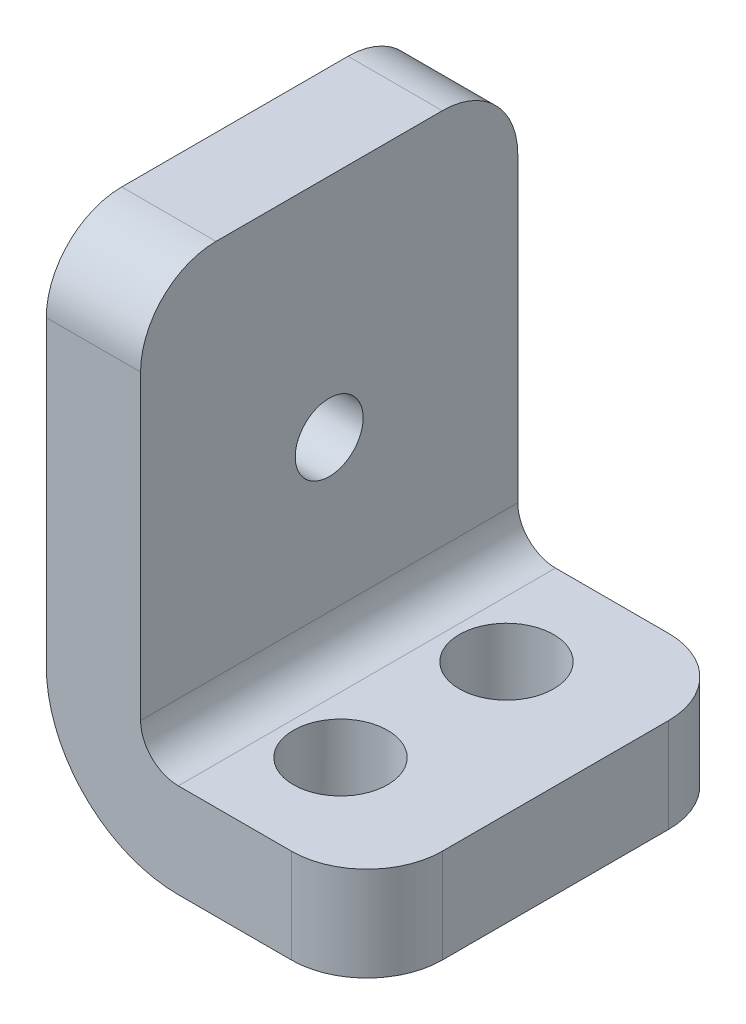
from build123d import *

# Parameters (mm, degrees)
BOSS_EXTRUDE1_DEPTH = 12.7
FILLET1_R           = 2.54
SKETCH2_R           = 1.143
CUT_EXTRUDE1_DEPTH  = 3.175
CUT_EXTRUDE2_REACH  = 22.36


with BuildPart() as part:
    # Sketch1 → Boss-Extrude1 (new body)
    with BuildSketch(Plane.XY):
        with BuildLine():
            Line((0, 25.690786623), (0, 12.990786623))
            ThreePointArc((0, 12.990786623), (0.371974388, 12.092761011), (1.27, 11.720786623))
            Line((1.27, 11.720786623), (7.62, 11.720786623))
            Line((7.62, 11.720786623), (7.62, 8.545786623))
            Line((7.62, 8.545786623), (1.27, 8.545786623))
            ThreePointArc((1.27, 8.545786623), (-1.873089642, 9.847696981), (-3.175, 12.990786623))
            Line((-3.175, 12.990786623), (-3.175, 25.690786623))
            Line((-3.175, 25.690786623), (0, 25.690786623))
        make_face()
    extrude(amount=BOSS_EXTRUDE1_DEPTH)

    # Fillet1
    fillet1_edges = [part.edges().sort_by_distance(p)[0] for p in [
        (-1.5875, 25.690786623, 0),
        (7.62, 10.133286623, 12.7),
        (-1.5875, 25.690786623, 12.7),
        (7.62, 10.133286623, 0),
    ]]
    fillet(fillet1_edges, radius=FILLET1_R)

    # Sketch2 → Cut-Extrude1 (cut)
    with BuildSketch(Plane(origin=(0, 0, 0), x_dir=(0, 0, -1), z_dir=(1, 0, 0))):
        with Locations((-6.35, 18.070786623)):
            Circle(SKETCH2_R)
    extrude(amount=-CUT_EXTRUDE1_DEPTH, mode=Mode.SUBTRACT)

    # Sketch3 → Cut-Extrude2 (cut, up to next)
    with BuildSketch(Plane(origin=(0, 11.720786623, 0), x_dir=(1, 0, 0), z_dir=(0, 1, 0)), mode=Mode.PRIVATE) as cut_extrude2_sk1:
        with BuildLine():
            ThreePointArc((3.175, -7.5565), (1.5875, -9.144), (3.175, -10.7315))
            Line((3.175, -10.7315), (3.175, -7.5565))
        make_face()
    cut_extrude2_tool1 = extrude(cut_extrude2_sk1.sketch, amount=-CUT_EXTRUDE2_REACH, mode=Mode.PRIVATE) & part.part
    # Sketch3 → Cut-Extrude2 (cut, up to next)
    with BuildSketch(Plane(origin=(0, 11.720786623, 0), x_dir=(1, 0, 0), z_dir=(0, 1, 0)), mode=Mode.PRIVATE) as cut_extrude2_sk2:
        with BuildLine():
            Line((3.175, -7.5565), (3.175, -10.7315))
            ThreePointArc((3.175, -10.7315), (4.297532015, -10.266532015), (4.7625, -9.144))
            ThreePointArc((4.7625, -9.144), (4.297532015, -8.021467985), (3.175, -7.5565))
        make_face()
    cut_extrude2_tool2 = extrude(cut_extrude2_sk2.sketch, amount=-CUT_EXTRUDE2_REACH, mode=Mode.PRIVATE) & part.part
    # Sketch3 → Cut-Extrude2 (cut, up to next)
    with BuildSketch(Plane(origin=(0, 11.720786623, 0), x_dir=(1, 0, 0), z_dir=(0, 1, 0)), mode=Mode.PRIVATE) as cut_extrude2_sk3:
        with BuildLine():
            ThreePointArc((3.175, -7.5565), (1.5875, -9.144), (3.175, -10.7315))
            Line((3.175, -10.7315), (3.175, -7.5565))
        make_face()
    cut_extrude2_tool3 = extrude(cut_extrude2_sk3.sketch, amount=-CUT_EXTRUDE2_REACH, mode=Mode.PRIVATE) & part.part
    # Sketch3 → Cut-Extrude2 (cut, up to next)
    with BuildSketch(Plane(origin=(0, 11.720786623, 0), x_dir=(1, 0, 0), z_dir=(0, 1, 0)), mode=Mode.PRIVATE) as cut_extrude2_sk4:
        with BuildLine():
            Line((3.175, -7.5565), (3.175, -10.7315))
            ThreePointArc((3.175, -10.7315), (4.297532015, -10.266532015), (4.7625, -9.144))
            ThreePointArc((4.7625, -9.144), (4.297532015, -8.021467985), (3.175, -7.5565))
        make_face()
    cut_extrude2_tool4 = extrude(cut_extrude2_sk4.sketch, amount=-CUT_EXTRUDE2_REACH, mode=Mode.PRIVATE) & part.part
    # Sketch3 → Cut-Extrude2 (cut, up to next)
    with BuildSketch(Plane(origin=(0, 11.720786623, 0), x_dir=(1, 0, 0), z_dir=(0, 1, 0)), mode=Mode.PRIVATE) as cut_extrude2_sk5:
        with BuildLine():
            ThreePointArc((3.175, -1.9685), (1.5875, -3.556), (3.175, -5.1435))
            Line((3.175, -5.1435), (3.175, -1.9685))
        make_face()
    cut_extrude2_tool5 = extrude(cut_extrude2_sk5.sketch, amount=-CUT_EXTRUDE2_REACH, mode=Mode.PRIVATE) & part.part
    # Sketch3 → Cut-Extrude2 (cut, up to next)
    with BuildSketch(Plane(origin=(0, 11.720786623, 0), x_dir=(1, 0, 0), z_dir=(0, 1, 0)), mode=Mode.PRIVATE) as cut_extrude2_sk6:
        with BuildLine():
            Line((3.175, -1.9685), (3.175, -5.1435))
            ThreePointArc((3.175, -5.1435), (4.297532015, -4.678532015), (4.7625, -3.556))
            ThreePointArc((4.7625, -3.556), (4.297532015, -2.433467985), (3.175, -1.9685))
        make_face()
    cut_extrude2_tool6 = extrude(cut_extrude2_sk6.sketch, amount=-CUT_EXTRUDE2_REACH, mode=Mode.PRIVATE) & part.part
    # Sketch3 → Cut-Extrude2 (cut, up to next)
    with BuildSketch(Plane(origin=(0, 11.720786623, 0), x_dir=(1, 0, 0), z_dir=(0, 1, 0)), mode=Mode.PRIVATE) as cut_extrude2_sk7:
        with BuildLine():
            ThreePointArc((3.175, -1.9685), (1.5875, -3.556), (3.175, -5.1435))
            Line((3.175, -5.1435), (3.175, -1.9685))
        make_face()
    cut_extrude2_tool7 = extrude(cut_extrude2_sk7.sketch, amount=-CUT_EXTRUDE2_REACH, mode=Mode.PRIVATE) & part.part
    # Sketch3 → Cut-Extrude2 (cut, up to next)
    with BuildSketch(Plane(origin=(0, 11.720786623, 0), x_dir=(1, 0, 0), z_dir=(0, 1, 0)), mode=Mode.PRIVATE) as cut_extrude2_sk8:
        with BuildLine():
            Line((3.175, -1.9685), (3.175, -5.1435))
            ThreePointArc((3.175, -5.1435), (4.297532015, -4.678532015), (4.7625, -3.556))
            ThreePointArc((4.7625, -3.556), (4.297532015, -2.433467985), (3.175, -1.9685))
        make_face()
    cut_extrude2_tool8 = extrude(cut_extrude2_sk8.sketch, amount=-CUT_EXTRUDE2_REACH, mode=Mode.PRIVATE) & part.part
    add(cut_extrude2_tool1.solids().sort_by_distance((2.501244, 11.720787, 9.144))[0], mode=Mode.SUBTRACT)
    add(cut_extrude2_tool2.solids().sort_by_distance((3.848756, 11.720787, 9.144))[0], mode=Mode.SUBTRACT)
    add(cut_extrude2_tool3.solids().sort_by_distance((2.501244, 11.720787, 9.144))[0], mode=Mode.SUBTRACT)
    add(cut_extrude2_tool4.solids().sort_by_distance((3.848756, 11.720787, 9.144))[0], mode=Mode.SUBTRACT)
    add(cut_extrude2_tool5.solids().sort_by_distance((2.501244, 11.720787, 3.556))[0], mode=Mode.SUBTRACT)
    add(cut_extrude2_tool6.solids().sort_by_distance((3.848756, 11.720787, 3.556))[0], mode=Mode.SUBTRACT)
    add(cut_extrude2_tool7.solids().sort_by_distance((2.501244, 11.720787, 3.556))[0], mode=Mode.SUBTRACT)
    add(cut_extrude2_tool8.solids().sort_by_distance((3.848756, 11.720787, 3.556))[0], mode=Mode.SUBTRACT)


solid = part.part
